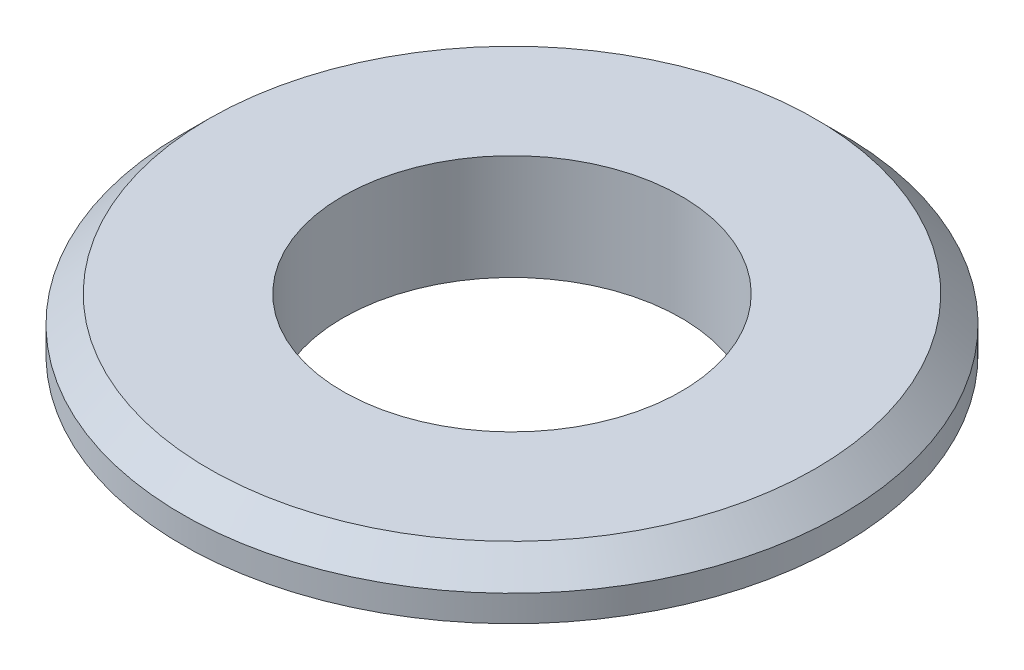
from build123d import *


with BuildPart() as part:
    # Sketch1 → Revolve1 (revolve)
    with BuildSketch(Plane.XY):
        Polygon((-4.8895, 0), (-4.8895, -3.048), (-6.35, -3.048), (-6.35, -1.524), (-9.525, -1.524), (-9.525, -0.762), (-8.763, 0), align=None)
    revolve(axis=Axis((0, 0, 0), (0, -1, 0)))


solid = part.part
